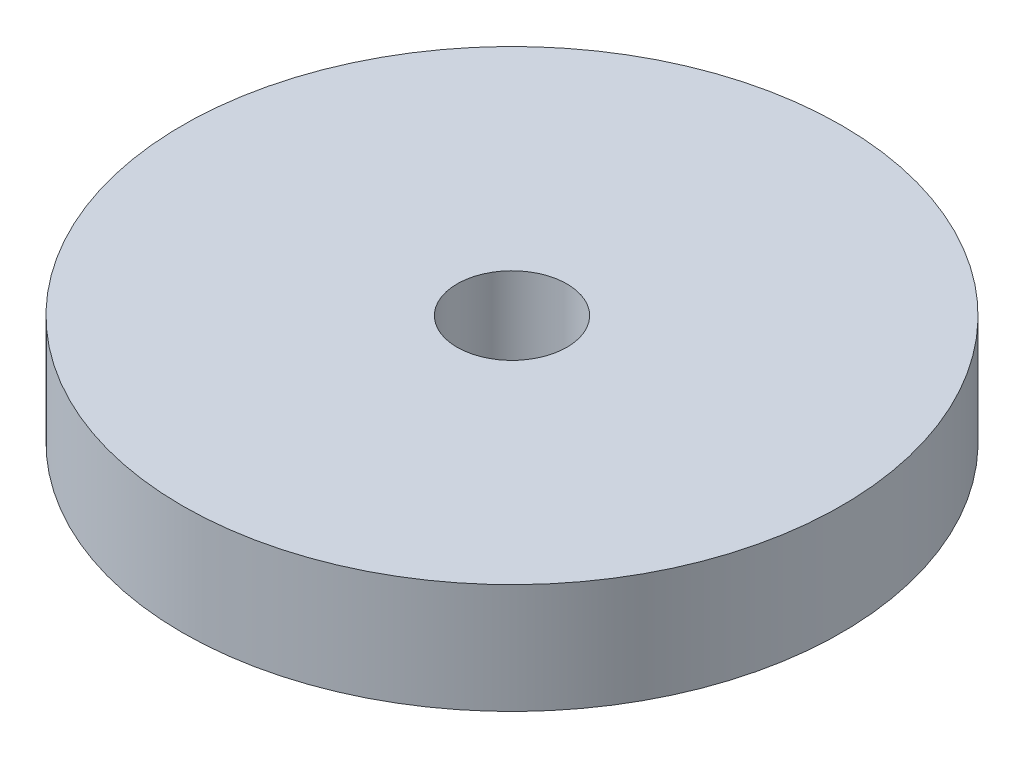
from build123d import *

# Parameters (mm, degrees)
SKETCH1_R           = 15
SKETCH1_R_2         = 2.5
BOSS_EXTRUDE1_DEPTH = 5


with BuildPart() as part:
    # Sketch1 → Boss-Extrude1 (new body)
    with BuildSketch(Plane(origin=(0, 0, 0), x_dir=(1, 0, 0), z_dir=(0, 1, 0))):
        with Locations(Location((0, 0, 0), (0, 0, 270))):
            Circle(SKETCH1_R)
        with Locations(Location((0, 0, 0), (0, 0, 270))):
            Circle(SKETCH1_R_2, mode=Mode.SUBTRACT)
    extrude(amount=BOSS_EXTRUDE1_DEPTH)


solid = part.part
